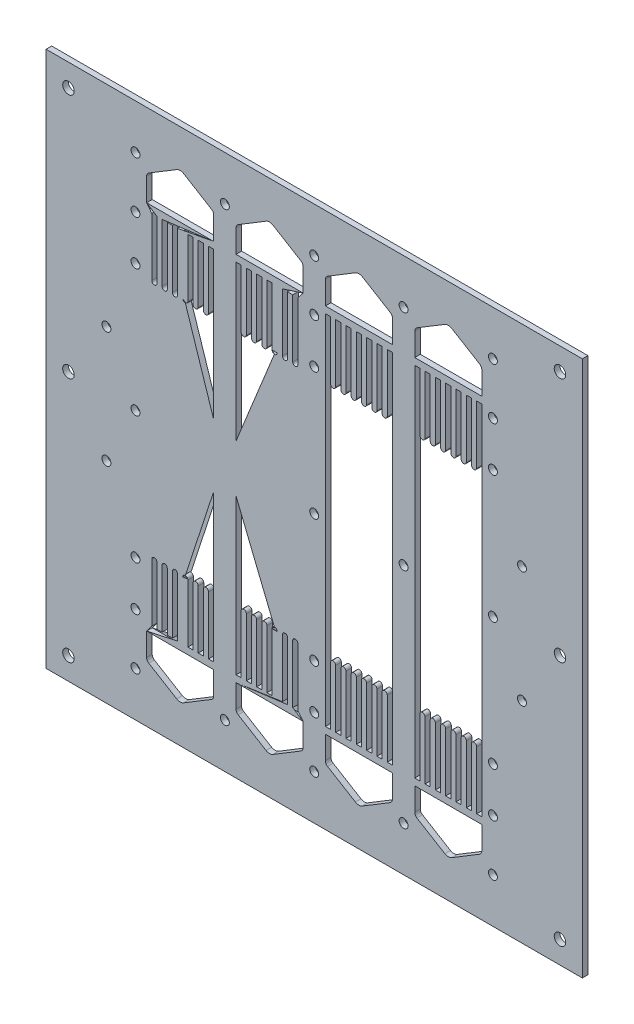
from build123d import *

# Parameters (mm, degrees)
SKETCH1_W           = 304.8
SKETCH1_H           = 304.8
SKETCH1_R           = 2.54
SKETCH1_R_2         = 3.2639
BOSS_EXTRUDE1_DEPTH = 3.175


with BuildPart() as part:
    # Sketch1 → Boss-Extrude1 (new body)
    with BuildSketch(Plane.XY):
        Rectangle(SKETCH1_W, SKETCH1_H)
        with Locations((-101.6, 0)):
            Circle(SKETCH1_R, mode=Mode.SUBTRACT)
        with Locations((-50.8, 0)):
            Circle(SKETCH1_R, mode=Mode.SUBTRACT)
        Circle(SKETCH1_R, mode=Mode.SUBTRACT)
        with Locations((101.6, 0)):
            Circle(SKETCH1_R, mode=Mode.SUBTRACT)
        with Locations((50.8, 0)):
            Circle(SKETCH1_R, mode=Mode.SUBTRACT)
        with Locations((-50.8, 127)):
            Circle(SKETCH1_R, mode=Mode.SUBTRACT)
        with Locations((0, 127)):
            Circle(SKETCH1_R, mode=Mode.SUBTRACT)
        with Locations((50.8, 127)):
            Circle(SKETCH1_R, mode=Mode.SUBTRACT)
        with Locations((-101.6, 72.39)):
            Circle(SKETCH1_R, mode=Mode.SUBTRACT)
        with Locations((0, 72.39)):
            Circle(SKETCH1_R, mode=Mode.SUBTRACT)
        with Locations((101.6, 72.39)):
            Circle(SKETCH1_R, mode=Mode.SUBTRACT)
        with Locations((-101.6, -72.39)):
            Circle(SKETCH1_R, mode=Mode.SUBTRACT)
        with Locations((0, -72.39)):
            Circle(SKETCH1_R, mode=Mode.SUBTRACT)
        with Locations((101.6, -72.39)):
            Circle(SKETCH1_R, mode=Mode.SUBTRACT)
        with Locations((50.8, -127)):
            Circle(SKETCH1_R, mode=Mode.SUBTRACT)
        with Locations((0, -127)):
            Circle(SKETCH1_R, mode=Mode.SUBTRACT)
        with Locations((-50.8, -127)):
            Circle(SKETCH1_R, mode=Mode.SUBTRACT)
        with Locations((-101.6, 97.79)):
            Circle(SKETCH1_R, mode=Mode.SUBTRACT)
        with Locations((0, 97.79)):
            Circle(SKETCH1_R, mode=Mode.SUBTRACT)
        with Locations((101.6, 97.79)):
            Circle(SKETCH1_R, mode=Mode.SUBTRACT)
        with Locations((101.6, 127)):
            Circle(SKETCH1_R, mode=Mode.SUBTRACT)
        with Locations((-101.6, 127)):
            Circle(SKETCH1_R, mode=Mode.SUBTRACT)
        with Locations((-118.11, 33.02)):
            Circle(SKETCH1_R, mode=Mode.SUBTRACT)
        with Locations((-101.6, -127)):
            Circle(SKETCH1_R, mode=Mode.SUBTRACT)
        with Locations((101.6, -127)):
            Circle(SKETCH1_R, mode=Mode.SUBTRACT)
        with Locations((101.6, -97.79)):
            Circle(SKETCH1_R, mode=Mode.SUBTRACT)
        with Locations((0, -97.79)):
            Circle(SKETCH1_R, mode=Mode.SUBTRACT)
        with Locations((-101.6, -97.79)):
            Circle(SKETCH1_R, mode=Mode.SUBTRACT)
        with Locations((-118.11, -33.02)):
            Circle(SKETCH1_R, mode=Mode.SUBTRACT)
        with Locations((-139.7, 139.7)):
            Circle(SKETCH1_R_2, mode=Mode.SUBTRACT)
        with Locations((-139.7, 0)):
            Circle(SKETCH1_R_2, mode=Mode.SUBTRACT)
        with Locations((-139.7, -139.7)):
            Circle(SKETCH1_R_2, mode=Mode.SUBTRACT)
        with Locations((139.7, -139.7)):
            Circle(SKETCH1_R_2, mode=Mode.SUBTRACT)
        with Locations((139.7, 0)):
            Circle(SKETCH1_R_2, mode=Mode.SUBTRACT)
        with Locations((139.7, 139.7)):
            Circle(SKETCH1_R_2, mode=Mode.SUBTRACT)
        with Locations((118.11, -33.02)):
            Circle(SKETCH1_R, mode=Mode.SUBTRACT)
        with Locations((118.11, 33.02)):
            Circle(SKETCH1_R, mode=Mode.SUBTRACT)
        with BuildLine():
            Line((-95.25, 105.41), (-57.15, 105.41))
            Line((-57.15, 105.41), (-57.15, 118.477864985))
            ThreePointArc((-57.15, 118.477864985), (-57.47688476, 119.724348412), (-58.37340231, 120.65))
            Line((-58.37340231, 120.65), (-74.225103465, 130.258202522))
            ThreePointArc((-74.225103465, 130.258202522), (-76.2, 130.81), (-78.174896535, 130.258202522))
            Line((-78.174896535, 130.258202522), (-94.02659769, 120.65))
            ThreePointArc((-94.02659769, 120.65), (-94.92311524, 119.724348412), (-95.25, 118.477864985))
            Line((-95.25, 118.477864985), (-95.25, 105.41))
        make_face(mode=Mode.SUBTRACT)
        with BuildLine():
            Line((-6.35, 105.41), (-6.35, 118.477864985))
            ThreePointArc((-6.35, 118.477864985), (-6.67688476, 119.724348412), (-7.57340231, 120.65))
            Line((-7.57340231, 120.65), (-23.425103465, 130.258202522))
            ThreePointArc((-23.425103465, 130.258202522), (-25.4, 130.81), (-27.374896535, 130.258202522))
            Line((-27.374896535, 130.258202522), (-43.22659769, 120.65))
            ThreePointArc((-43.22659769, 120.65), (-44.12311524, 119.724348412), (-44.45, 118.477864985))
            Line((-44.45, 118.477864985), (-44.45, 105.41))
            Line((-44.45, 105.41), (-6.35, 105.41))
        make_face(mode=Mode.SUBTRACT)
        with BuildLine():
            Line((44.45, 105.41), (44.45, 118.477864985))
            ThreePointArc((44.45, 118.477864985), (44.12311524, 119.724348412), (43.22659769, 120.65))
            Line((43.22659769, 120.65), (27.374896535, 130.258202522))
            ThreePointArc((27.374896535, 130.258202522), (25.4, 130.81), (23.425103465, 130.258202522))
            Line((23.425103465, 130.258202522), (7.57340231, 120.65))
            ThreePointArc((7.57340231, 120.65), (6.67688476, 119.724348412), (6.35, 118.477864985))
            Line((6.35, 118.477864985), (6.35, 105.41))
            Line((6.35, 105.41), (44.45, 105.41))
        make_face(mode=Mode.SUBTRACT)
        with BuildLine():
            Line((95.25, 105.41), (57.15, 105.41))
            Line((57.15, 105.41), (57.15, 118.477864985))
            ThreePointArc((57.15, 118.477864985), (57.47688476, 119.724348412), (58.37340231, 120.65))
            Line((58.37340231, 120.65), (74.225103465, 130.258202522))
            ThreePointArc((74.225103465, 130.258202522), (76.2, 130.81), (78.174896535, 130.258202522))
            Line((78.174896535, 130.258202522), (94.02659769, 120.65))
            ThreePointArc((94.02659769, 120.65), (94.92311524, 119.724348412), (95.25, 118.477864985))
            Line((95.25, 118.477864985), (95.25, 105.41))
        make_face(mode=Mode.SUBTRACT)
        with BuildLine():
            Line((-95.25, -105.41), (-95.25, -118.477864985))
            ThreePointArc((-95.25, -118.477864985), (-94.92311524, -119.724348412), (-94.02659769, -120.65))
            Line((-94.02659769, -120.65), (-78.174896535, -130.258202522))
            ThreePointArc((-78.174896535, -130.258202522), (-76.2, -130.81), (-74.225103465, -130.258202522))
            Line((-74.225103465, -130.258202522), (-58.37340231, -120.65))
            ThreePointArc((-58.37340231, -120.65), (-57.47688476, -119.724348412), (-57.15, -118.477864985))
            Line((-57.15, -118.477864985), (-57.15, -105.41))
            Line((-57.15, -105.41), (-95.25, -105.41))
        make_face(mode=Mode.SUBTRACT)
        with BuildLine():
            Line((-44.45, -105.41), (-44.45, -118.477864985))
            ThreePointArc((-44.45, -118.477864985), (-44.12311524, -119.724348412), (-43.22659769, -120.65))
            Line((-43.22659769, -120.65), (-27.374896535, -130.258202522))
            ThreePointArc((-27.374896535, -130.258202522), (-25.4, -130.81), (-23.425103465, -130.258202522))
            Line((-23.425103465, -130.258202522), (-7.57340231, -120.65))
            ThreePointArc((-7.57340231, -120.65), (-6.67688476, -119.724348412), (-6.35, -118.477864985))
            Line((-6.35, -118.477864985), (-6.35, -105.41))
            Line((-6.35, -105.41), (-44.45, -105.41))
        make_face(mode=Mode.SUBTRACT)
        with BuildLine():
            Line((6.35, -105.41), (6.35, -118.477864985))
            ThreePointArc((6.35, -118.477864985), (6.67688476, -119.724348412), (7.57340231, -120.65))
            Line((7.57340231, -120.65), (23.425103465, -130.258202522))
            ThreePointArc((23.425103465, -130.258202522), (25.4, -130.81), (27.374896535, -130.258202522))
            Line((27.374896535, -130.258202522), (43.22659769, -120.65))
            ThreePointArc((43.22659769, -120.65), (44.12311524, -119.724348412), (44.45, -118.477864985))
            Line((44.45, -118.477864985), (44.45, -105.41))
            Line((44.45, -105.41), (6.35, -105.41))
        make_face(mode=Mode.SUBTRACT)
        with BuildLine():
            Line((57.15, -105.41), (57.15, -118.477864985))
            ThreePointArc((57.15, -118.477864985), (57.47688476, -119.724348412), (58.37340231, -120.65))
            Line((58.37340231, -120.65), (74.225103465, -130.258202522))
            ThreePointArc((74.225103465, -130.258202522), (76.2, -130.81), (78.174896535, -130.258202522))
            Line((78.174896535, -130.258202522), (94.02659769, -120.65))
            ThreePointArc((94.02659769, -120.65), (94.92311524, -119.724348412), (95.25, -118.477864985))
            Line((95.25, -118.477864985), (95.25, -105.41))
            Line((95.25, -105.41), (57.15, -105.41))
        make_face(mode=Mode.SUBTRACT)
        with BuildLine():
            Line((-95.25, 101.6), (-92.319230769, 101.6))
            Line((-92.319230769, 101.6), (-92.319230769, 68.58))
            ThreePointArc((-92.319230769, 68.58), (-90.853846154, 67.114615385), (-89.388461538, 68.58))
            Line((-89.388461538, 68.58), (-89.388461538, 101.6))
            Line((-89.388461538, 101.6), (-86.457692308, 101.6))
            Line((-86.457692308, 101.6), (-86.457692308, 68.58))
            ThreePointArc((-86.457692308, 68.58), (-84.992307692, 67.114615385), (-83.526923077, 68.58))
            Line((-83.526923077, 68.58), (-83.526923077, 101.6))
            Line((-83.526923077, 101.6), (-80.596153846, 101.6))
            Line((-80.596153846, 101.6), (-80.596153846, 68.58))
            ThreePointArc((-80.596153846, 68.58), (-79.130769231, 67.114615385), (-77.665384615, 68.58))
            Line((-77.665384615, 68.58), (-77.665384615, 101.6))
            Line((-77.665384615, 101.6), (-74.734615385, 101.6))
            Line((-74.734615385, 101.6), (-74.734615385, 68.58))
            ThreePointArc((-74.734615385, 68.58), (-73.269230769, 67.114615385), (-71.803846154, 68.58))
            Line((-71.803846154, 68.58), (-71.803846154, 101.6))
            Line((-71.803846154, 101.6), (-68.873076923, 101.6))
            Line((-68.873076923, 101.6), (-68.873076923, 68.58))
            ThreePointArc((-68.873076923, 68.58), (-67.407692308, 67.114615385), (-65.942307692, 68.58))
            Line((-65.942307692, 68.58), (-65.942307692, 101.6))
            Line((-65.942307692, 101.6), (-63.011538462, 101.6))
            Line((-63.011538462, 101.6), (-63.011538462, 68.58))
            ThreePointArc((-63.011538462, 68.58), (-61.546153846, 67.114615385), (-60.080769231, 68.58))
            Line((-60.080769231, 68.58), (-60.080769231, 101.6))
            Line((-60.080769231, 101.6), (-57.15, 101.6))
            Line((-57.15, 101.6), (-57.15, -101.6))
            Line((-57.15, -101.6), (-60.080769231, -101.6))
            Line((-60.080769231, -101.6), (-60.080769231, -68.58))
            ThreePointArc((-60.080769231, -68.58), (-61.546153846, -67.114615385), (-63.011538462, -68.58))
            Line((-63.011538462, -68.58), (-63.011538462, -101.6))
            Line((-63.011538462, -101.6), (-65.942307692, -101.6))
            Line((-65.942307692, -101.6), (-65.942307692, -68.58))
            ThreePointArc((-65.942307692, -68.58), (-67.407692308, -67.114615385), (-68.873076923, -68.58))
            Line((-68.873076923, -68.58), (-68.873076923, -101.6))
            Line((-68.873076923, -101.6), (-71.803846154, -101.6))
            Line((-71.803846154, -101.6), (-71.803846154, -68.58))
            ThreePointArc((-71.803846154, -68.58), (-73.269230769, -67.114615385), (-74.734615385, -68.58))
            Line((-74.734615385, -68.58), (-74.734615385, -101.6))
            Line((-74.734615385, -101.6), (-77.665384615, -101.6))
            Line((-77.665384615, -101.6), (-77.665384615, -68.58))
            ThreePointArc((-77.665384615, -68.58), (-79.130769231, -67.114615385), (-80.596153846, -68.58))
            Line((-80.596153846, -68.58), (-80.596153846, -101.6))
            Line((-80.596153846, -101.6), (-83.526923077, -101.6))
            Line((-83.526923077, -101.6), (-83.526923077, -68.58))
            ThreePointArc((-83.526923077, -68.58), (-84.992307692, -67.114615385), (-86.457692308, -68.58))
            Line((-86.457692308, -68.58), (-86.457692308, -101.6))
            Line((-86.457692308, -101.6), (-89.388461538, -101.6))
            Line((-89.388461538, -101.6), (-89.388461538, -68.58))
            ThreePointArc((-89.388461538, -68.58), (-90.853846154, -67.114615385), (-92.319230769, -68.58))
            Line((-92.319230769, -68.58), (-92.319230769, -101.6))
            Line((-92.319230769, -101.6), (-95.25, -101.6))
            Line((-95.25, -101.6), (-95.25, 101.6))
        make_face(mode=Mode.SUBTRACT)
        with BuildLine():
            Line((-6.35, -101.6), (-9.280769231, -101.6))
            Line((-9.280769231, -101.6), (-9.280769231, -68.58))
            ThreePointArc((-9.280769231, -68.58), (-10.746153846, -67.114615385), (-12.211538462, -68.58))
            Line((-12.211538462, -68.58), (-12.211538462, -101.6))
            Line((-12.211538462, -101.6), (-15.142307692, -101.6))
            Line((-15.142307692, -101.6), (-15.142307692, -68.58))
            ThreePointArc((-15.142307692, -68.58), (-16.607692308, -67.114615385), (-18.073076923, -68.58))
            Line((-18.073076923, -68.58), (-18.073076923, -101.6))
            Line((-18.073076923, -101.6), (-21.003846154, -101.6))
            Line((-21.003846154, -101.6), (-21.003846154, -68.58))
            ThreePointArc((-21.003846154, -68.58), (-22.469230769, -67.114615385), (-23.934615385, -68.58))
            Line((-23.934615385, -68.58), (-23.934615385, -101.6))
            Line((-23.934615385, -101.6), (-26.865384615, -101.6))
            Line((-26.865384615, -101.6), (-26.865384615, -68.58))
            ThreePointArc((-26.865384615, -68.58), (-28.330769231, -67.114615385), (-29.796153846, -68.58))
            Line((-29.796153846, -68.58), (-29.796153846, -101.6))
            Line((-29.796153846, -101.6), (-32.726923077, -101.6))
            Line((-32.726923077, -101.6), (-32.726923077, -68.58))
            ThreePointArc((-32.726923077, -68.58), (-34.192307692, -67.114615385), (-35.657692308, -68.58))
            Line((-35.657692308, -68.58), (-35.657692308, -101.6))
            Line((-35.657692308, -101.6), (-38.588461538, -101.6))
            Line((-38.588461538, -101.6), (-38.588461538, -68.58))
            ThreePointArc((-38.588461538, -68.58), (-40.053846154, -67.114615385), (-41.519230769, -68.58))
            Line((-41.519230769, -68.58), (-41.519230769, -101.6))
            Line((-41.519230769, -101.6), (-44.45, -101.6))
            Line((-44.45, -101.6), (-44.45, 101.6))
            Line((-44.45, 101.6), (-41.519230769, 101.6))
            Line((-41.519230769, 101.6), (-41.519230769, 68.58))
            ThreePointArc((-41.519230769, 68.58), (-40.053846154, 67.114615385), (-38.588461538, 68.58))
            Line((-38.588461538, 68.58), (-38.588461538, 101.6))
            Line((-38.588461538, 101.6), (-35.657692308, 101.6))
            Line((-35.657692308, 101.6), (-35.657692308, 68.58))
            ThreePointArc((-35.657692308, 68.58), (-34.192307692, 67.114615385), (-32.726923077, 68.58))
            Line((-32.726923077, 68.58), (-32.726923077, 101.6))
            Line((-32.726923077, 101.6), (-29.796153846, 101.6))
            Line((-29.796153846, 101.6), (-29.796153846, 68.58))
            ThreePointArc((-29.796153846, 68.58), (-28.330769231, 67.114615385), (-26.865384615, 68.58))
            Line((-26.865384615, 68.58), (-26.865384615, 101.6))
            Line((-26.865384615, 101.6), (-23.934615385, 101.6))
            Line((-23.934615385, 101.6), (-23.934615385, 68.58))
            ThreePointArc((-23.934615385, 68.58), (-22.469230769, 67.114615385), (-21.003846154, 68.58))
            Line((-21.003846154, 68.58), (-21.003846154, 101.6))
            Line((-21.003846154, 101.6), (-18.073076923, 101.6))
            Line((-18.073076923, 101.6), (-18.073076923, 68.58))
            ThreePointArc((-18.073076923, 68.58), (-16.607692308, 67.114615385), (-15.142307692, 68.58))
            Line((-15.142307692, 68.58), (-15.142307692, 101.6))
            Line((-15.142307692, 101.6), (-12.211538462, 101.6))
            Line((-12.211538462, 101.6), (-12.211538462, 68.58))
            ThreePointArc((-12.211538462, 68.58), (-10.746153846, 67.114615385), (-9.280769231, 68.58))
            Line((-9.280769231, 68.58), (-9.280769231, 101.6))
            Line((-9.280769231, 101.6), (-6.35, 101.6))
            Line((-6.35, 101.6), (-6.35, -101.6))
        make_face(mode=Mode.SUBTRACT)
        with BuildLine():
            Line((6.35, 101.6), (9.280769231, 101.6))
            Line((9.280769231, 101.6), (9.280769231, 68.58))
            ThreePointArc((9.280769231, 68.58), (10.746153846, 67.114615385), (12.211538462, 68.58))
            Line((12.211538462, 68.58), (12.211538462, 101.6))
            Line((12.211538462, 101.6), (15.142307692, 101.6))
            Line((15.142307692, 101.6), (15.142307692, 68.58))
            ThreePointArc((15.142307692, 68.58), (16.607692308, 67.114615385), (18.073076923, 68.58))
            Line((18.073076923, 68.58), (18.073076923, 101.6))
            Line((18.073076923, 101.6), (21.003846154, 101.6))
            Line((21.003846154, 101.6), (21.003846154, 68.58))
            ThreePointArc((21.003846154, 68.58), (22.469230769, 67.114615385), (23.934615385, 68.58))
            Line((23.934615385, 68.58), (23.934615385, 101.6))
            Line((23.934615385, 101.6), (26.865384615, 101.6))
            Line((26.865384615, 101.6), (26.865384615, 68.58))
            ThreePointArc((26.865384615, 68.58), (28.330769231, 67.114615385), (29.796153846, 68.58))
            Line((29.796153846, 68.58), (29.796153846, 101.6))
            Line((29.796153846, 101.6), (32.726923077, 101.6))
            Line((32.726923077, 101.6), (32.726923077, 68.58))
            ThreePointArc((32.726923077, 68.58), (34.192307692, 67.114615385), (35.657692308, 68.58))
            Line((35.657692308, 68.58), (35.657692308, 101.6))
            Line((35.657692308, 101.6), (38.588461538, 101.6))
            Line((38.588461538, 101.6), (38.588461538, 68.58))
            ThreePointArc((38.588461538, 68.58), (40.053846154, 67.114615385), (41.519230769, 68.58))
            Line((41.519230769, 68.58), (41.519230769, 101.6))
            Line((41.519230769, 101.6), (44.45, 101.6))
            Line((44.45, 101.6), (44.45, -101.6))
            Line((44.45, -101.6), (41.519230769, -101.6))
            Line((41.519230769, -101.6), (41.519230769, -68.58))
            ThreePointArc((41.519230769, -68.58), (40.053846154, -67.114615385), (38.588461538, -68.58))
            Line((38.588461538, -68.58), (38.588461538, -101.6))
            Line((38.588461538, -101.6), (35.657692308, -101.6))
            Line((35.657692308, -101.6), (35.657692308, -68.58))
            ThreePointArc((35.657692308, -68.58), (34.192307692, -67.114615385), (32.726923077, -68.58))
            Line((32.726923077, -68.58), (32.726923077, -101.6))
            Line((32.726923077, -101.6), (29.796153846, -101.6))
            Line((29.796153846, -101.6), (29.796153846, -68.58))
            ThreePointArc((29.796153846, -68.58), (28.330769231, -67.114615385), (26.865384615, -68.58))
            Line((26.865384615, -68.58), (26.865384615, -101.6))
            Line((26.865384615, -101.6), (23.934615385, -101.6))
            Line((23.934615385, -101.6), (23.934615385, -68.58))
            ThreePointArc((23.934615385, -68.58), (22.469230769, -67.114615385), (21.003846154, -68.58))
            Line((21.003846154, -68.58), (21.003846154, -101.6))
            Line((21.003846154, -101.6), (18.073076923, -101.6))
            Line((18.073076923, -101.6), (18.073076923, -68.58))
            ThreePointArc((18.073076923, -68.58), (16.607692308, -67.114615385), (15.142307692, -68.58))
            Line((15.142307692, -68.58), (15.142307692, -101.6))
            Line((15.142307692, -101.6), (12.211538462, -101.6))
            Line((12.211538462, -101.6), (12.211538462, -68.58))
            ThreePointArc((12.211538462, -68.58), (10.746153846, -67.114615385), (9.280769231, -68.58))
            Line((9.280769231, -68.58), (9.280769231, -101.6))
            Line((9.280769231, -101.6), (6.35, -101.6))
            Line((6.35, -101.6), (6.35, 101.6))
        make_face(mode=Mode.SUBTRACT)
        with BuildLine():
            Line((95.25, -101.6), (92.319230769, -101.6))
            Line((92.319230769, -101.6), (92.319230769, -68.58))
            ThreePointArc((92.319230769, -68.58), (90.853846154, -67.114615385), (89.388461538, -68.58))
            Line((89.388461538, -68.58), (89.388461538, -101.6))
            Line((89.388461538, -101.6), (86.457692308, -101.6))
            Line((86.457692308, -101.6), (86.457692308, -68.58))
            ThreePointArc((86.457692308, -68.58), (84.992307692, -67.114615385), (83.526923077, -68.58))
            Line((83.526923077, -68.58), (83.526923077, -101.6))
            Line((83.526923077, -101.6), (80.596153846, -101.6))
            Line((80.596153846, -101.6), (80.596153846, -68.58))
            ThreePointArc((80.596153846, -68.58), (79.130769231, -67.114615385), (77.665384615, -68.58))
            Line((77.665384615, -68.58), (77.665384615, -101.6))
            Line((77.665384615, -101.6), (74.734615385, -101.6))
            Line((74.734615385, -101.6), (74.734615385, -68.58))
            ThreePointArc((74.734615385, -68.58), (73.269230769, -67.114615385), (71.803846154, -68.58))
            Line((71.803846154, -68.58), (71.803846154, -101.6))
            Line((71.803846154, -101.6), (68.873076923, -101.6))
            Line((68.873076923, -101.6), (68.873076923, -68.58))
            ThreePointArc((68.873076923, -68.58), (67.407692308, -67.114615385), (65.942307692, -68.58))
            Line((65.942307692, -68.58), (65.942307692, -101.6))
            Line((65.942307692, -101.6), (63.011538462, -101.6))
            Line((63.011538462, -101.6), (63.011538462, -68.58))
            ThreePointArc((63.011538462, -68.58), (61.546153846, -67.114615385), (60.080769231, -68.58))
            Line((60.080769231, -68.58), (60.080769231, -101.6))
            Line((60.080769231, -101.6), (57.15, -101.6))
            Line((57.15, -101.6), (57.15, 101.6))
            Line((57.15, 101.6), (60.080769231, 101.6))
            Line((60.080769231, 101.6), (60.080769231, 68.58))
            ThreePointArc((60.080769231, 68.58), (61.546153846, 67.114615385), (63.011538462, 68.58))
            Line((63.011538462, 68.58), (63.011538462, 101.6))
            Line((63.011538462, 101.6), (65.942307692, 101.6))
            Line((65.942307692, 101.6), (65.942307692, 68.58))
            ThreePointArc((65.942307692, 68.58), (67.407692308, 67.114615385), (68.873076923, 68.58))
            Line((68.873076923, 68.58), (68.873076923, 101.6))
            Line((68.873076923, 101.6), (71.803846154, 101.6))
            Line((71.803846154, 101.6), (71.803846154, 68.58))
            ThreePointArc((71.803846154, 68.58), (73.269230769, 67.114615385), (74.734615385, 68.58))
            Line((74.734615385, 68.58), (74.734615385, 101.6))
            Line((74.734615385, 101.6), (77.665384615, 101.6))
            Line((77.665384615, 101.6), (77.665384615, 68.58))
            ThreePointArc((77.665384615, 68.58), (79.130769231, 67.114615385), (80.596153846, 68.58))
            Line((80.596153846, 68.58), (80.596153846, 101.6))
            Line((80.596153846, 101.6), (83.526923077, 101.6))
            Line((83.526923077, 101.6), (83.526923077, 68.58))
            ThreePointArc((83.526923077, 68.58), (84.992307692, 67.114615385), (86.457692308, 68.58))
            Line((86.457692308, 68.58), (86.457692308, 101.6))
            Line((86.457692308, 101.6), (89.388461538, 101.6))
            Line((89.388461538, 101.6), (89.388461538, 68.58))
            ThreePointArc((89.388461538, 68.58), (90.853846154, 67.114615385), (92.319230769, 68.58))
            Line((92.319230769, 68.58), (92.319230769, 101.6))
            Line((92.319230769, 101.6), (95.25, 101.6))
            Line((95.25, 101.6), (95.25, -101.6))
        make_face(mode=Mode.SUBTRACT)
    extrude(amount=BOSS_EXTRUDE1_DEPTH)


solid = part.part
